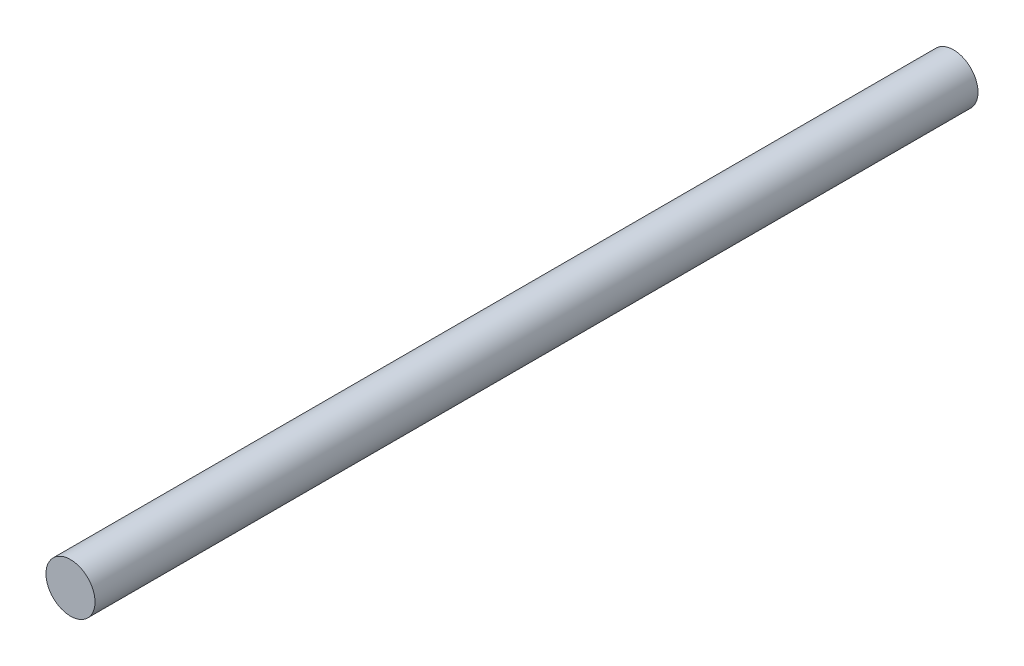
from build123d import *

# Parameters (mm, degrees)
SKETCH1_R           = 3.175
BOSS_EXTRUDE1_DEPTH = 114.3


with BuildPart() as part:
    # Sketch1 → Boss-Extrude1 (new body)
    with BuildSketch(Plane.XY):
        Circle(SKETCH1_R)
    extrude(amount=BOSS_EXTRUDE1_DEPTH)


solid = part.part
